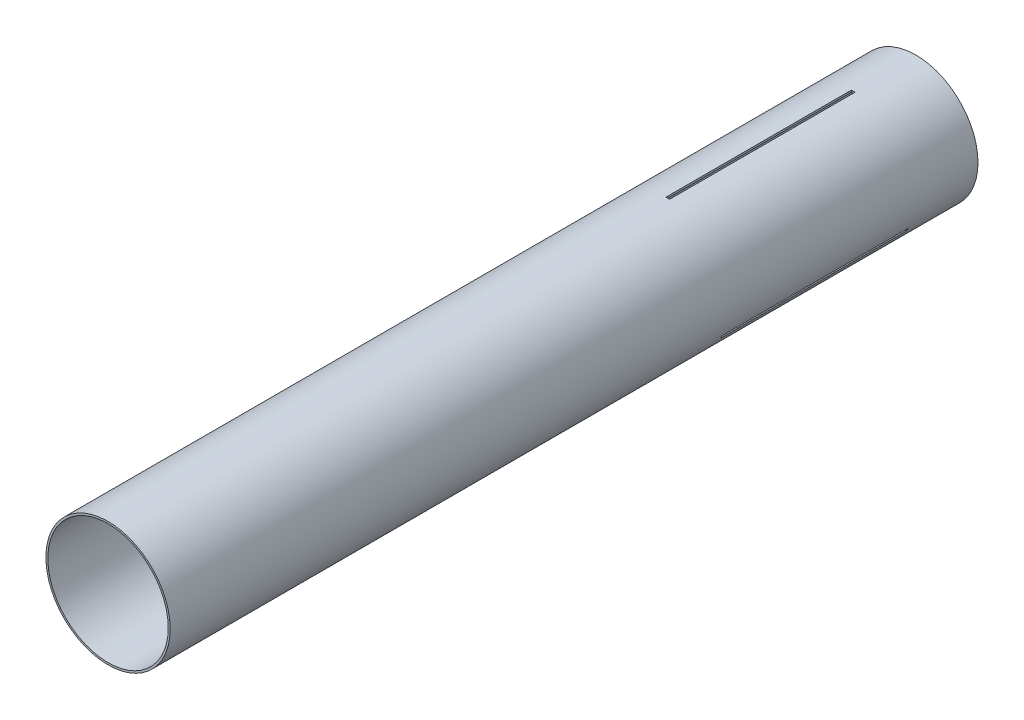
from build123d import *

# Parameters (mm, degrees)
SKETCH1_R           = 50.8
SKETCH1_R_2         = 49.2125
BOSS_EXTRUDE1_DEPTH = 660.4
CUT_EXTRUDE3_START  = 51.1937
SKETCH4_W           = 2.9972
SKETCH4_H           = 25.4
CUT_EXTRUDE3_DEPTH  = 151.6126


with BuildPart() as part:
    # Sketch1 → Boss-Extrude1 (new body)
    with BuildSketch(Plane.XY):
        Circle(SKETCH1_R)
        Circle(SKETCH1_R_2, mode=Mode.SUBTRACT)
    extrude(amount=BOSS_EXTRUDE1_DEPTH)

    # Sketch4 → Cut-Extrude3 (cut)
    with BuildSketch(Plane.XY.offset(CUT_EXTRUDE3_START)):
        Polygon((54.24331314, -33.04782567), (32.246267884, -20.34782567), (33.744867884, -17.75217433), (55.74191314, -30.45217433), align=None)
        with Locations((0, 50.8)):
            Rectangle(SKETCH4_W, SKETCH4_H)
        Polygon((-55.74191314, -30.45217433), (-33.744867884, -17.75217433), (-32.246267884, -20.34782567), (-54.24331314, -33.04782567), align=None)
    extrude(amount=CUT_EXTRUDE3_DEPTH, mode=Mode.SUBTRACT)


solid = part.part
